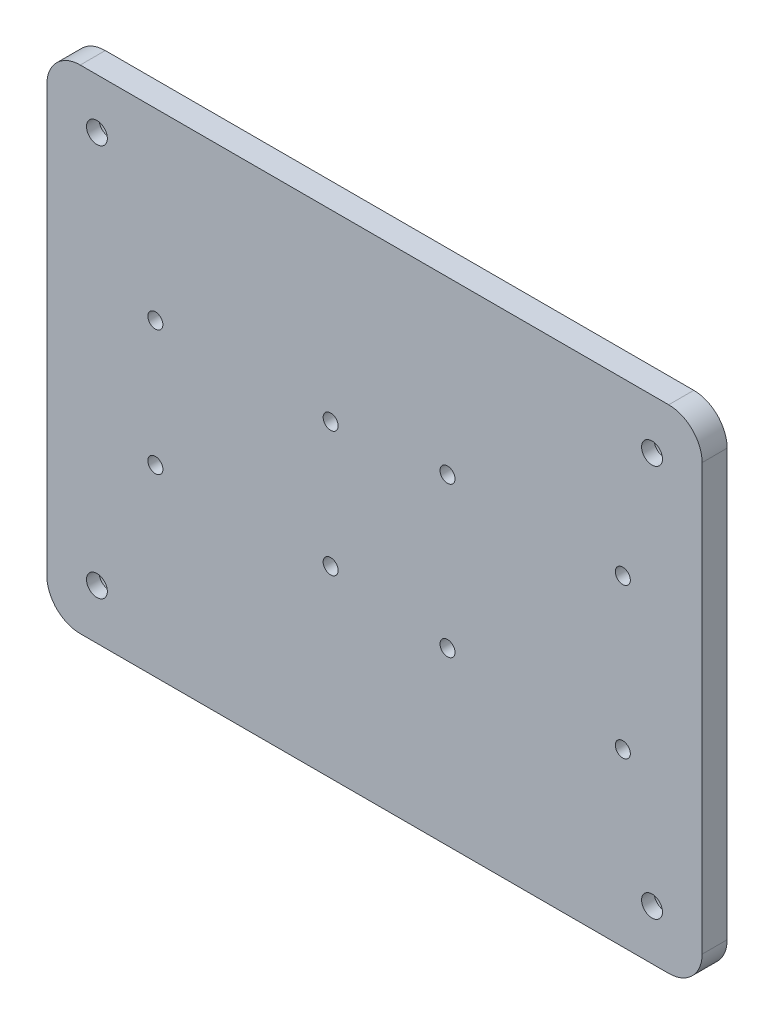
from build123d import *

# Parameters (mm, degrees)
SKETCH_2_W          = 170
SKETCH_2_H          = 20
EXTRUDE_1_DEPTH     = 23
CUT_EXTRUDE_1_DEPTH = 173.710740836
SKETCH_4_W          = 17
SKETCH_4_H          = 13
CUT_EXTRUDE_2_DEPTH = 30
CUT_EXTRUDE_3_DEPTH = 173.710740836
SKETCH_6_W          = 87.5
SKETCH_6_H          = 63
EXTRUDE_2_DEPTH     = 3
SKETCH_7_R          = 1.25
CUT_EXTRUDE_4_DEPTH = 186.632028486
SKETCH_7_3_R        = 2
CUT_EXTRUDE_5_DEPTH = 1.5
CUT_EXTRUDE_6_DEPTH = 186.632028486
FILLET_2_R          = 4
SKETCH_10_R         = 0.9
CUT_EXTRUDE_7_DEPTH = 186.178967488
SKETCH_9_W          = 78.5
SKETCH_9_H          = 16.208535094
CUT_EXTRUDE_8_DEPTH = 191.475720238


with BuildPart() as part:
    # 草图2 → 凸台-拉伸1 (new body)
    with BuildSketch(Plane(origin=(0, 0, 0), x_dir=(1, 0, 0), z_dir=(0, 1, 0))):
        with Locations((85, -10)):
            Rectangle(SKETCH_2_W, SKETCH_2_H)
    extrude(amount=EXTRUDE_1_DEPTH)

    # 草图3 → 切除-拉伸1 (cut, through all)
    with BuildSketch(Plane(origin=(0, 23, 0), x_dir=(1, 0, 0), z_dir=(0, 1, 0))):
        with BuildLine():
            ThreePointArc((161.6, -10), (159.341699476, -8.541699476), (158.941699476, -11.2))
            Line((158.941699476, -11.2), (161.058300524, -11.2))
            ThreePointArc((161.058300524, -11.2), (161.458300524, -10.658300524), (161.6, -10))
        make_face()
        with BuildLine():
            ThreePointArc((126.6, -10), (124.341699476, -8.541699476), (123.941699476, -11.2))
            Line((123.941699476, -11.2), (126.058300524, -11.2))
            ThreePointArc((126.058300524, -11.2), (126.458300524, -10.658300524), (126.6, -10))
        make_face()
    extrude(amount=-CUT_EXTRUDE_1_DEPTH, mode=Mode.SUBTRACT)

    # 草图4 → 切除-拉伸2 (cut)
    with BuildSketch(Plane(origin=(170, 0, 0), x_dir=(0, 0, -1), z_dir=(1, 0, 0))):
        with Locations((-8.5, 11.5)):
            Rectangle(SKETCH_4_W, SKETCH_4_H)
    extrude(amount=-CUT_EXTRUDE_2_DEPTH, mode=Mode.SUBTRACT)

    # 草图5 → 切除-拉伸3 (cut, through all)
    with BuildSketch(Plane(origin=(0, 23, 0), x_dir=(1, 0, 0), z_dir=(0, 1, 0))):
        with BuildLine():
            Line((117.5, -17), (117.5, -10))
            ThreePointArc((117.5, -10), (125, -2.5), (132.5, -10))
            Line((132.5, -10), (132.5, -17))
            Line((132.5, -17), (152.5, -17))
            Line((152.5, -17), (152.5, -10))
            ThreePointArc((152.5, -10), (160, -2.5), (167.5, -10))
            Line((167.5, -10), (167.5, -17))
            Line((167.5, -17), (170, -17))
            Line((170, -17), (170, 0))
            Line((170, 0), (0, 0))
            Line((0, 0), (0, -20))
            Line((0, -20), (102.5, -20))
            Line((102.5, -20), (102.5, -17))
            Line((102.5, -17), (117.5, -17))
        make_face()
    extrude(amount=-CUT_EXTRUDE_3_DEPTH, mode=Mode.SUBTRACT)

    # 草图6 → 凸台-拉伸2 (add)
    with BuildSketch(Plane.XY.offset(20)):
        with Locations((136.25, 11.5)):
            Rectangle(SKETCH_6_W, SKETCH_6_H)
    extrude(amount=-EXTRUDE_2_DEPTH)

    # 草图7 → 切除-拉伸4 (cut, through all)
    with BuildSketch(Plane(origin=(0, 0, 17), x_dir=(-1, 0, 0), z_dir=(0, 0, -1))):
        with Locations((-174, 35)):
            Circle(SKETCH_7_R)
        with Locations((-107.5, 35)):
            Circle(SKETCH_7_R)
        with Locations((-107.5, -12)):
            Circle(SKETCH_7_R)
        with Locations((-174, -12)):
            Circle(SKETCH_7_R)
    extrude(amount=-CUT_EXTRUDE_4_DEPTH, mode=Mode.SUBTRACT)

    # 草图7<3> → 切除-拉伸5 (cut)
    with BuildSketch(Plane(origin=(0, 0, 17), x_dir=(-1, 0, 0), z_dir=(0, 0, -1))):
        with Locations((-174, 35)):
            Circle(SKETCH_7_3_R)
        with Locations((-107.5, 35)):
            Circle(SKETCH_7_3_R)
        with Locations((-174, -12)):
            Circle(SKETCH_7_3_R)
        with Locations((-107.5, -12)):
            Circle(SKETCH_7_3_R)
    extrude(amount=-CUT_EXTRUDE_5_DEPTH, mode=Mode.SUBTRACT)

    # 草图8 → 切除-拉伸6 (cut, through all)
    with BuildSketch(Plane(origin=(0, 0, 17), x_dir=(-1, 0, 0), z_dir=(0, 0, -1))):
        Polygon((-180, 43), (-180, 41), (-101.5, 41), (-101.5, -18), (-180, -18), (-180, -20), (-92.5, -20), (-92.5, 43), align=None)
    extrude(amount=-CUT_EXTRUDE_6_DEPTH, mode=Mode.SUBTRACT)

    # 圆角2
    fillet_2_edges = [part.edges().sort_by_distance(p)[0] for p in [
        (101.5, -18, 18.5),
        (101.5, 41, 18.5),
        (180, 41, 18.5),
        (180, -18, 18.5),
    ]]
    fillet(fillet_2_edges, radius=FILLET_2_R)

    # 草图10 → 切除-拉伸7 (cut, through all)
    with BuildSketch(Plane(origin=(0, 0, 17), x_dir=(-1, 0, 0), z_dir=(0, 0, -1))):
        with Locations((-170.5, 20.5)):
            Circle(SKETCH_10_R)
        with Locations((-149.5, 20.5)):
            Circle(SKETCH_10_R)
        with Locations((-170.5, 2.5)):
            Circle(SKETCH_10_R)
        with Locations((-149.5, 2.5)):
            Circle(SKETCH_10_R)
        with Locations((-135.5, 4)):
            Circle(SKETCH_10_R)
        with Locations((-135.5, 19)):
            Circle(SKETCH_10_R)
        with Locations((-114.5, 19)):
            Circle(SKETCH_10_R)
        with Locations((-114.5, 4)):
            Circle(SKETCH_10_R)
    extrude(amount=-CUT_EXTRUDE_7_DEPTH, mode=Mode.SUBTRACT)

    # 草图9 → 切除-拉伸8 (cut, through all)
    with BuildSketch(Plane.XZ.offset(18)):
        with Locations((140.75, 8.895732453)):
            Rectangle(SKETCH_9_W, SKETCH_9_H)
    extrude(amount=-CUT_EXTRUDE_8_DEPTH, mode=Mode.SUBTRACT)


solid = part.part
